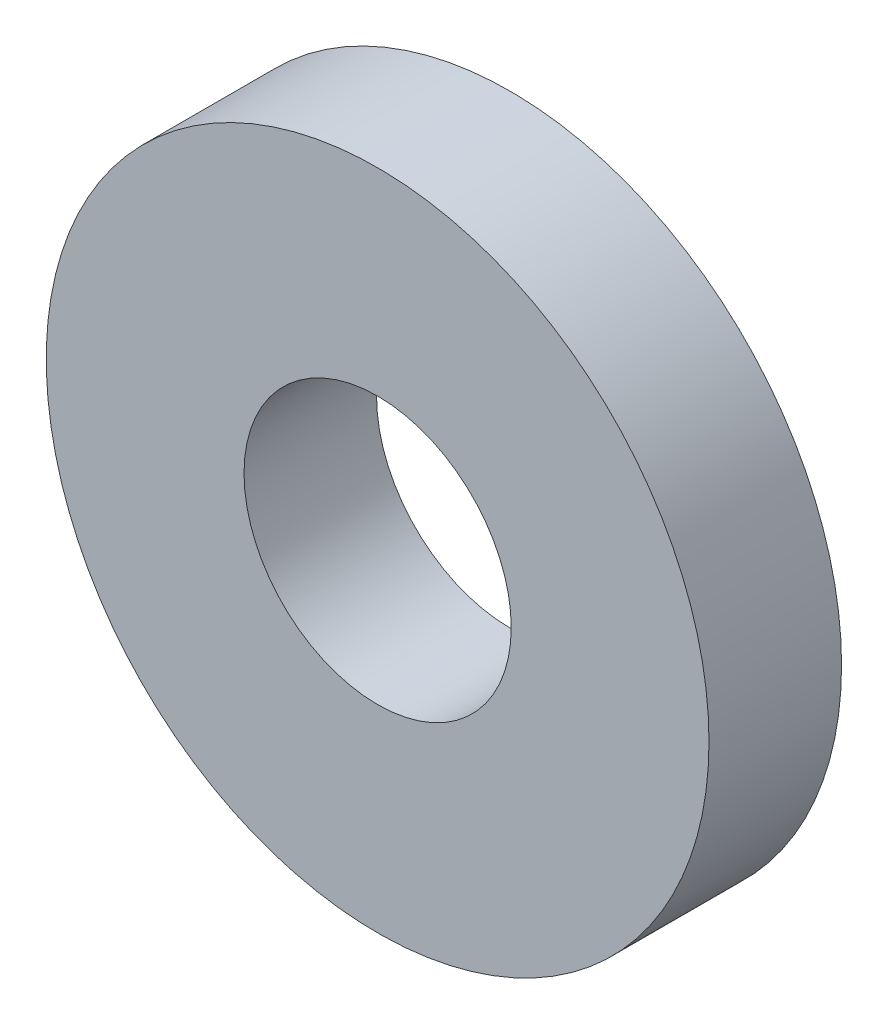
from build123d import *

# Parameters (mm, degrees)
SKETCH1_R      = 7.9375
SKETCH1_R_2    = 3.2004
EXTRUDE1_DEPTH = 1.5875


with BuildPart() as part:
    # Sketch1 → Extrude1 (new, symmetric)
    with BuildSketch(Plane.XY):
        Circle(SKETCH1_R)
        Circle(SKETCH1_R_2, mode=Mode.SUBTRACT)
    extrude(amount=EXTRUDE1_DEPTH, both=True)


solid = part.part
